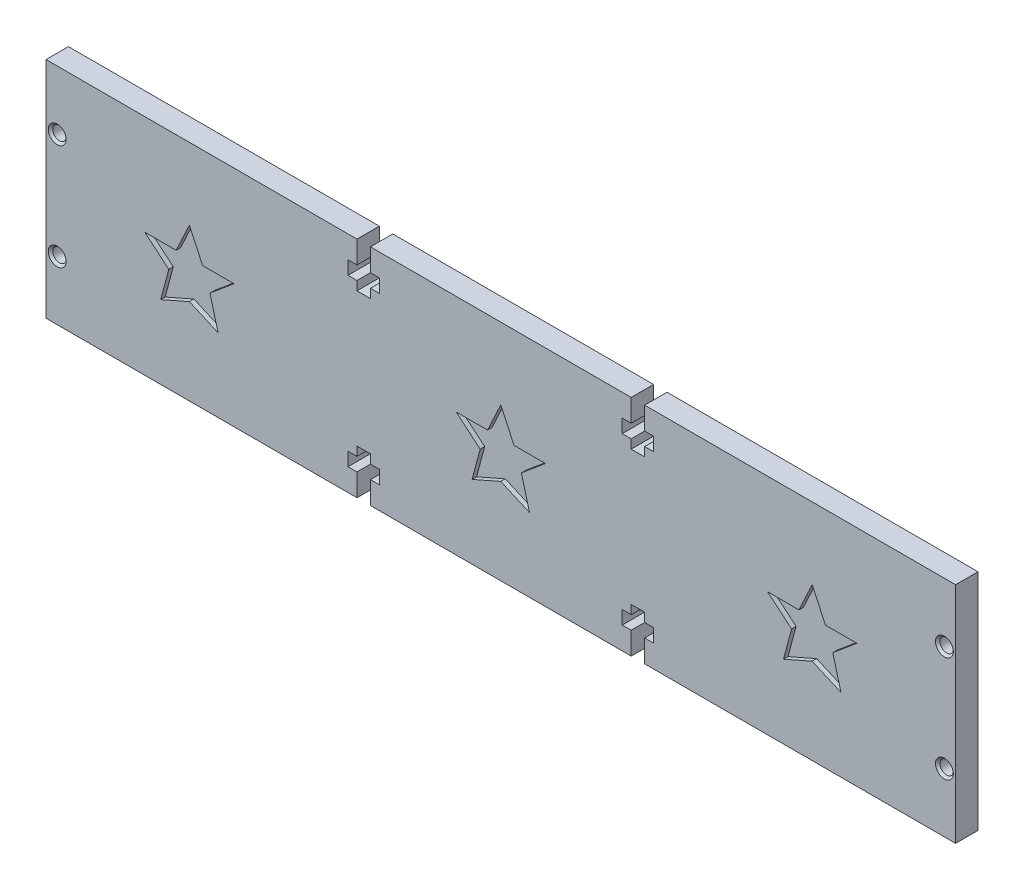
from build123d import *

# Parameters (mm, degrees)
SKETCH1_W                       = 257.81
SKETCH1_H                       = 63.5
BOSS_EXTRUDE1_DEPTH             = 6.35
CUT_EXTRUDE2_DEPTH              = 1.27
CUT_EXTRUDE3_DEPTH              = 266.590979892
F_6_CLEARANCE_HOLE1_D           = 3.7973
F_6_CLEARANCE_HOLE1_CSINK_D     = 5.0673
F_6_CLEARANCE_HOLE1_CSINK_ANGLE = 90


with BuildPart() as part:
    # Sketch1 → Boss-Extrude1 (new body)
    with BuildSketch(Plane.XY):
        with Locations((128.905, -31.75)):
            Rectangle(SKETCH1_W, SKETCH1_H)
    extrude(amount=BOSS_EXTRUDE1_DEPTH)

    # Sketch4 → Cut-Extrude2 (cut)
    with BuildSketch(Plane.XY.offset(6.35)):
        Polygon((128.905, -20.32), (125.147923653, -28.377076227), (116.257923653, -28.377076227), (123.068058752, -34.091458077), (120.767157441, -42.678538673), (128.905, -39.09976535), (137.042842559, -42.678538673), (134.741941248, -34.091458077), (141.552076347, -28.377076227), (132.662076347, -28.377076227), align=None)
        Polygon((217.17, -20.32), (213.412923653, -28.377076227), (204.522923653, -28.377076227), (211.333058752, -34.091458077), (209.032157441, -42.678538673), (217.17, -39.09976535), (225.307842559, -42.678538673), (223.006941248, -34.091458077), (229.817076347, -28.377076227), (220.927076347, -28.377076227), align=None)
        Polygon((40.64, -20.32), (36.882923653, -28.377076227), (27.992923653, -28.377076227), (34.803058752, -34.091458077), (32.502157441, -42.678538673), (40.64, -39.09976535), (48.777842559, -42.678538673), (46.476941248, -34.091458077), (53.287076347, -28.377076227), (44.397076347, -28.377076227), align=None)
    extrude(amount=-CUT_EXTRUDE2_DEPTH, mode=Mode.SUBTRACT)

    # Sketch6 → Cut-Extrude3 (cut, through all)
    with BuildSketch(Plane.XY.offset(6.35)):
        Polygon((88.138, 0), (91.948, 0), (91.948, -6.35), (94.488, -6.35), (94.488, -10.16), (91.948, -10.16), (91.948, -12.7), (88.138, -12.7), (88.138, -10.16), (85.598, -10.16), (85.598, -6.35), (88.138, -6.35), align=None)
        Polygon((165.862, 0), (169.672, 0), (169.672, -6.35), (172.212, -6.35), (172.212, -10.16), (169.672, -10.16), (169.672, -12.7), (165.862, -12.7), (165.862, -10.16), (163.322, -10.16), (163.322, -6.35), (165.862, -6.35), align=None)
        Polygon((88.138, -63.5), (91.948, -63.5), (91.948, -57.15), (94.488, -57.15), (94.488, -53.34), (91.948, -53.34), (91.948, -50.8), (88.138, -50.8), (88.138, -53.34), (85.598, -53.34), (85.598, -57.15), (88.138, -57.15), align=None)
        Polygon((165.862, -63.5), (169.672, -63.5), (169.672, -57.15), (172.212, -57.15), (172.212, -53.34), (169.672, -53.34), (169.672, -50.8), (165.862, -50.8), (165.862, -53.34), (163.322, -53.34), (163.322, -57.15), (165.862, -57.15), align=None)
    extrude(amount=-CUT_EXTRUDE3_DEPTH, mode=Mode.SUBTRACT)

    # #6 Clearance Hole1 (through all)
    with Locations(Plane.XY.offset(6.35)):
        with Locations((3.175, -16.764), (3.175, -46.736), (254.635, -46.736), (254.635, -16.764)):
            CounterSinkHole(F_6_CLEARANCE_HOLE1_D / 2, F_6_CLEARANCE_HOLE1_CSINK_D / 2, counter_sink_angle=F_6_CLEARANCE_HOLE1_CSINK_ANGLE)


solid = part.part
